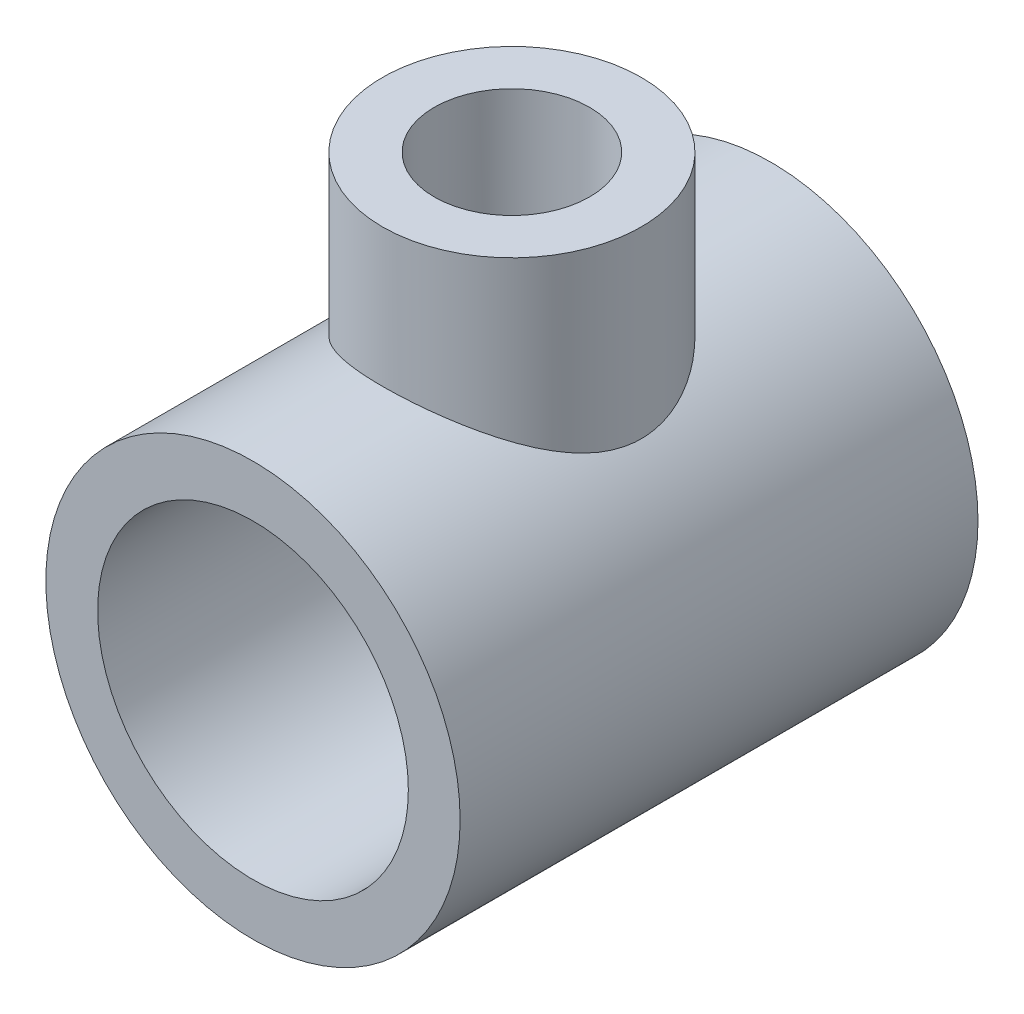
from build123d import *

# Parameters (mm, degrees)
CROQUIS1_R              = 24
CROQUIS1_R_2            = 18
SALIENTE_EXTRUIR1_DEPTH = 30
CROQUIS2_R              = 15
CROQUIS2_R_2            = 9
SALIENTE_EXTRUIR2_DEPTH = 40


with BuildPart() as part:
    # Croquis1 → Saliente-Extruir1 (new, symmetric)
    with BuildSketch(Plane.XY):
        Circle(CROQUIS1_R)
        Circle(CROQUIS1_R_2, mode=Mode.SUBTRACT)
    extrude(amount=SALIENTE_EXTRUIR1_DEPTH, both=True)

    # Croquis2 → Saliente-Extruir2 (add)
    with BuildSketch(Plane(origin=(0, 0, 0), x_dir=(1, 0, 0), z_dir=(0, 1, 0))):
        with Locations(Location((0, 0, 0), (0, 0, 90))):
            Circle(CROQUIS2_R)
        with Locations(Location((0, 0, 0), (0, 0, 90))):
            Circle(CROQUIS2_R_2, mode=Mode.SUBTRACT)
    extrude(amount=SALIENTE_EXTRUIR2_DEPTH)


solid = part.part
